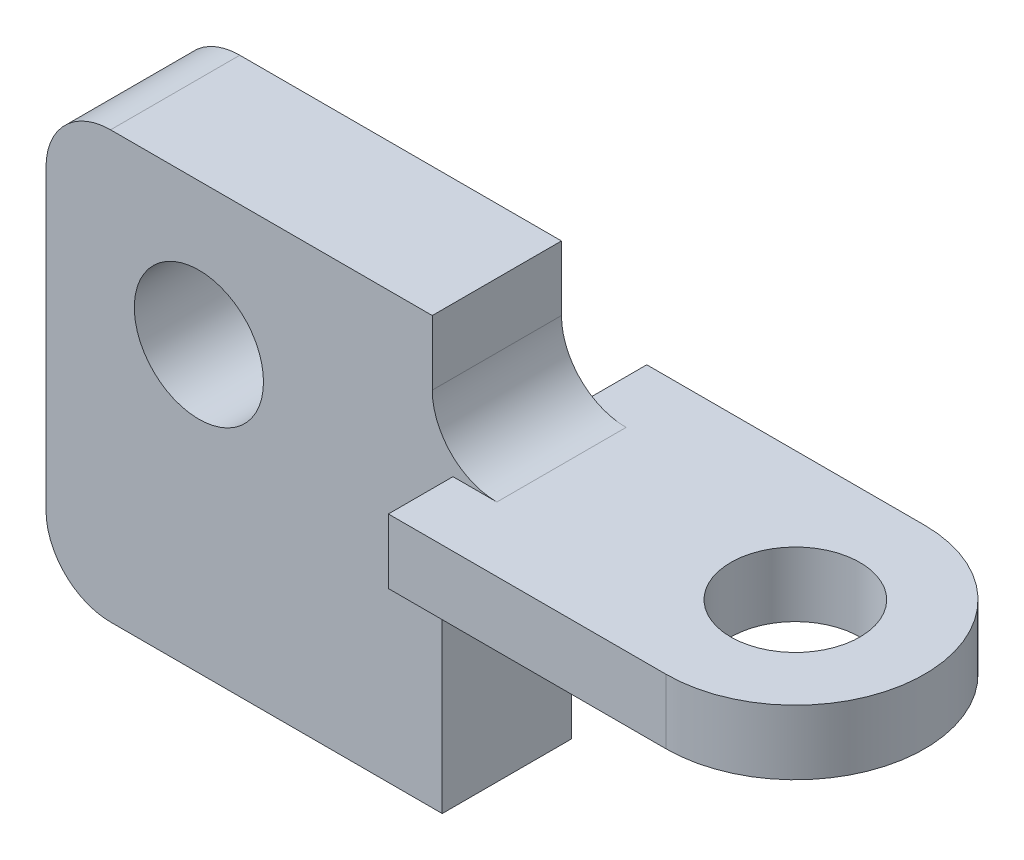
from build123d import *

# Parameters (mm, degrees)
BOSS_EXTRUDE1_DEPTH      = 508
BOSS_EXTRUDE1_DEPTH_BACK = 914.4
SKETCH1_W                = 1772.805842697
SKETCH1_H                = 508
SKETCH1_3_R              = 254
BOSS_EXTRUDE2_DEPTH      = 254
SKETCH1_4_W              = 1772.805842697
SKETCH1_4_H              = 508
BOSS_EXTRUDE3_DEPTH      = 762
CUT_EXTRUDE1_DEPTH       = 608.260771289
FILLET2_R                = 254
FILLET3_R                = 254
SKETCH12_R               = 254
CUT_EXTRUDE2_DEPTH       = 614.68


with BuildPart() as part:
    # Sketch1 → Boss-Extrude1 (new, two sides: drawn at the far end of the back side and taken through both)
    with BuildSketch(Plane(origin=(0, 0, 0), x_dir=(1, 0, 0), z_dir=(0, 1, 0)).offset(-BOSS_EXTRUDE1_DEPTH_BACK)):
        with Locations((886.402921349, 0)):
            Rectangle(SKETCH1_W, SKETCH1_H)
    extrude(amount=BOSS_EXTRUDE1_DEPTH + BOSS_EXTRUDE1_DEPTH_BACK)

    # Sketch1<3> → Boss-Extrude2 (add)
    with BuildSketch(Plane(origin=(0, 0, 0), x_dir=(1, 0, 0), z_dir=(0, 1, 0))):
        with BuildLine():
            Line((1772.805842697, -254), (1600.2, -254))
            Line((1600.2, -254), (1600.2, -508))
            Line((1600.2, -508), (2692.4, -508))
            ThreePointArc((2692.4, -508), (3200.4, 0), (2692.4, 508))
            Line((2692.4, 508), (1600.2, 508))
            Line((1600.2, 508), (1600.2, 254))
            Line((1600.2, 254), (1772.805842697, 254))
            Line((1772.805842697, 254), (1772.805842697, -254))
        make_face()
        with Locations((2692.4, 0)):
            Circle(SKETCH1_3_R, mode=Mode.SUBTRACT)
    extrude(amount=BOSS_EXTRUDE2_DEPTH)

    # Sketch1<4> → Boss-Extrude3 (add)
    with BuildSketch(Plane(origin=(0, 0, 0), x_dir=(1, 0, 0), z_dir=(0, 1, 0))):
        with Locations((886.402921349, 0)):
            Rectangle(SKETCH1_4_W, SKETCH1_4_H)
    extrude(amount=BOSS_EXTRUDE3_DEPTH)

    # Sketch11 → Cut-Extrude1 (cut)
    with BuildSketch(Plane.XY.offset(254)):
        with BuildLine():
            Line((1518.805842697, 508), (1518.805842697, 762))
            Line((1518.805842697, 762), (1772.805842697, 762))
            Line((1772.805842697, 762), (1772.805842697, 254))
            ThreePointArc((1772.805842697, 254), (1593.200720275, 328.394877579), (1518.805842697, 508))
        make_face()
        with BuildLine():
            Line((1557.94858799, -214.857254707), (1557.94858799, -914.4))
            Line((1557.94858799, -914.4), (1772.805842697, -914.4))
            Line((1772.805842697, -914.4), (1772.805842697, 0))
            ThreePointArc((1772.805842697, 0), (1620.878820906, -62.930232917), (1557.94858799, -214.857254707))
        make_face()
    extrude(amount=-CUT_EXTRUDE1_DEPTH, mode=Mode.SUBTRACT)

    # Fillet2
    fillet2_edges = [part.edges().sort_by_distance(p)[0] for p in [
        (0, 762, 0),
    ]]
    fillet(fillet2_edges, radius=FILLET2_R)

    # Fillet3
    fillet3_edges = [part.edges().sort_by_distance(p)[0] for p in [
        (0, -914.4, 0),
    ]]
    fillet(fillet3_edges, radius=FILLET3_R)

    # Sketch12 → Cut-Extrude2 (cut)
    with BuildSketch(Plane.XY.offset(254)):
        with Locations((601.129209232, 204.050012336)):
            Circle(SKETCH12_R)
    extrude(amount=-CUT_EXTRUDE2_DEPTH, mode=Mode.SUBTRACT)


solid = part.part
